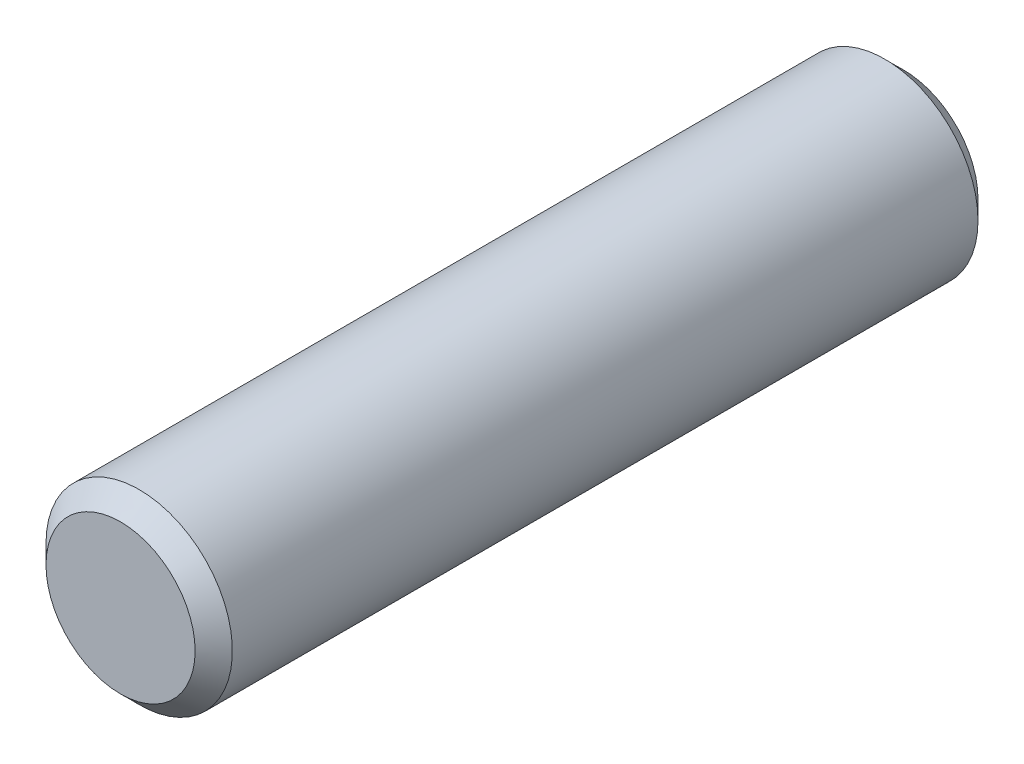
from build123d import *

# Parameters (mm, degrees)
SKETCH1_R           = 10
BOSS_EXTRUDE1_DEPTH = 84
CHAMFER1_SIZE       = 2


with BuildPart() as part:
    # Sketch1 → Boss-Extrude1 (new body)
    with BuildSketch(Plane.XY):
        with Locations(Location((0, 0, 0), (0, 0, 180))):
            Circle(SKETCH1_R)
    extrude(amount=BOSS_EXTRUDE1_DEPTH)

    # Chamfer1
    chamfer1_edges = [part.edges().sort_by_distance(p)[0] for p in [
        (10, 0, 0),
        (10, 0, 84),
    ]]
    chamfer(chamfer1_edges, length=CHAMFER1_SIZE)


solid = part.part
